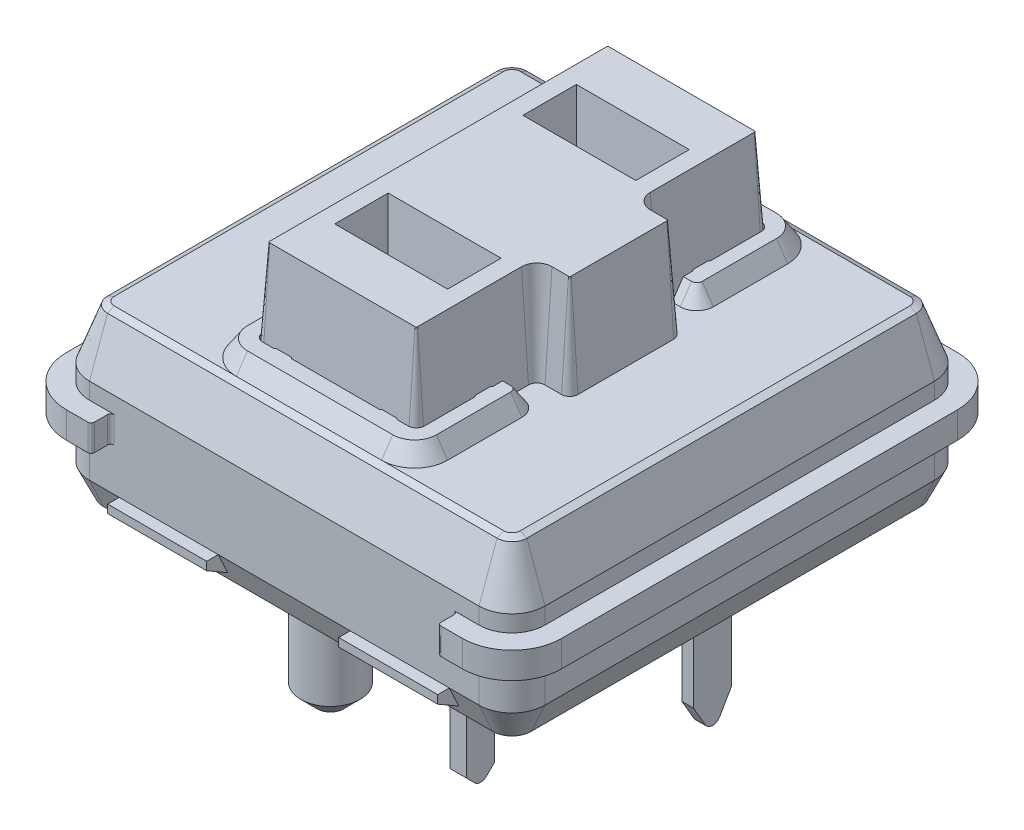
from build123d import *
from OCP.BRepFilletAPI import BRepFilletAPI_MakeChamfer

# Parameters (mm, degrees)
BOSS_EXTRUDE4_DEPTH  = 0.4
BOSS_EXTRUDE5_DEPTH  = 0.5
BOSS_EXTRUDE6_DEPTH  = 1.6
BOSS_EXTRUDE6_TAPER  = 20.000000000000043
CHAMFER1_SIZE        = 0.1
CHAMFER1_SIZE2       = 0.16731571851014881
BOSS_EXTRUDE7_DEPTH  = 0.5
BOSS_EXTRUDE7_TAPER  = 34.000000000000064
CUT_EXTRUDE1_DEPTH   = 11.995908329919814
BOSS_EXTRUDE8_DEPTH  = 0.5
BOSS_EXTRUDE9_DEPTH  = 3
BOSS_EXTRUDE9_DRAFT  = 4.000000000000004
BOSS_EXTRUDE10_START = 1.3
BOSS_EXTRUDE10_DEPTH = 1.3
BOSS_EXTRUDE11_DEPTH = 0.9000000000000002
BOSS_EXTRUDE11_TAPER = 25.000000000000018
CUT_EXTRUDE4_DEPTH   = 4
SKETCH19_R           = 1.6
SKETCH19_R_2         = 0.8999999999999999
BOSS_EXTRUDE12_DEPTH = 2.65
CHAMFER2_SIZE        = 0.5
SKETCH20_W           = 0.34999999999999964
SKETCH20_H           = 1.15
SKETCH20_W_2         = 0.5
SKETCH20_H_2         = 0.8499999999999996
BOSS_EXTRUDE13_DEPTH = 3
CUT_EXTRUDE5_REACH   = 18.489
BOSS_EXTRUDE14_START = 2
BOSS_EXTRUDE14_DEPTH = 3
MIRROR2_START        = 2
MIRROR2_COPY_1_DEPTH = 3
CUT_EXTRUDE6_REACH   = 14.137
SKETCH23_W           = 10.5
SKETCH23_H           = 0.599999999999997
FILLET1_R            = 0.1


with BuildPart() as part:
    # Sketch5 → Boss-Extrude4 (new, symmetric)
    with BuildSketch(Plane(origin=(0, 0, 0), x_dir=(1, 0, 0), z_dir=(0, 1, 0))):
        with BuildLine():
            Line((5.999999999999988, -7.4999999999999964), (-5.999999999999988, -7.4999999999999964))
            ThreePointArc((-5.999999999999988, -7.4999999999999964), (-7.06066017177982, -7.060660171779818), (-7.499999999999999, -5.999999999999986))
            Line((-7.499999999999999, -5.999999999999986), (-7.499999999999999, 5.999999999999986))
            ThreePointArc((-7.499999999999999, 5.999999999999986), (-7.06066017177982, 7.060660171779818), (-5.999999999999988, 7.4999999999999964))
            Line((-5.999999999999988, 7.4999999999999964), (5.999999999999988, 7.4999999999999964))
            ThreePointArc((5.999999999999988, 7.4999999999999964), (7.06066017177982, 7.060660171779817), (7.499999999999999, 5.999999999999986))
            Line((7.499999999999999, 5.999999999999986), (7.499999999999999, -5.999999999999986))
            ThreePointArc((7.499999999999999, -5.999999999999986), (7.06066017177982, -7.060660171779817), (5.999999999999988, -7.4999999999999964))
        make_face()
    extrude(amount=BOSS_EXTRUDE4_DEPTH, both=True)

    # Sketch6 → Boss-Extrude5 (add)
    with BuildSketch(Plane(origin=(0, 0.4, 0), x_dir=(1, 0, 0), z_dir=(0, 1, 0))):
        with BuildLine():
            Line((5.899999999999993, -6.900000000000001), (-5.899999999999995, -6.900000000000001))
            ThreePointArc((-5.899999999999995, -6.900000000000001), (-6.607106781186548, -6.607106781186549), (-6.900000000000001, -5.899999999999995))
            Line((-6.900000000000001, -5.899999999999995), (-6.900000000000001, 5.899999999999992))
            ThreePointArc((-6.900000000000001, 5.899999999999992), (-6.607106781186548, 6.6071067811865465), (-5.899999999999995, 6.899999999999999))
            Line((-5.899999999999995, 6.899999999999999), (5.899999999999992, 6.899999999999999))
            ThreePointArc((5.899999999999992, 6.899999999999999), (6.6071067811865465, 6.6071067811865465), (6.899999999999999, 5.899999999999992))
            Line((6.899999999999999, 5.899999999999992), (6.8999999999999995, -5.899999999999995))
            ThreePointArc((6.8999999999999995, -5.899999999999995), (6.607106781186547, -6.607106781186548), (5.899999999999993, -6.900000000000001))
        make_face()
    extrude(amount=BOSS_EXTRUDE5_DEPTH)

    # Sketch7 → Boss-Extrude6 (add)
    with BuildSketch(Plane(origin=(0, 0.9, 0), x_dir=(1, 0, 0), z_dir=(0, 1, 0))):
        with BuildLine():
            Line((-6.900000000000001, 5.899999999999992), (-6.900000000000001, -5.899999999999995))
            ThreePointArc((-6.900000000000001, -5.899999999999995), (-6.607106781186549, -6.607106781186548), (-5.899999999999995, -6.900000000000001))
            Line((-5.899999999999995, -6.900000000000001), (5.899999999999993, -6.900000000000001))
            ThreePointArc((5.899999999999993, -6.900000000000001), (6.607106781186547, -6.607106781186548), (6.8999999999999995, -5.899999999999995))
            Line((6.8999999999999995, -5.899999999999995), (6.899999999999999, 5.899999999999992))
            ThreePointArc((6.899999999999999, 5.899999999999992), (6.6071067811865465, 6.6071067811865465), (5.899999999999992, 6.899999999999999))
            Line((5.899999999999992, 6.899999999999999), (-5.899999999999995, 6.899999999999999))
            ThreePointArc((-5.899999999999995, 6.899999999999999), (-6.607106781186548, 6.6071067811865465), (-6.900000000000001, 5.899999999999992))
        make_face()
    extrude(amount=BOSS_EXTRUDE6_DEPTH, taper=BOSS_EXTRUDE6_TAPER)

    # Chamfer1: one chamfer whose edges measure the first distance from different faces: ONE call of the kernel's chamfer builder (chamfer() names one face for all edges)
    chamfer1_edges_1 = [part.edges().sort_by_distance(p)[0] for p in [
        (-6.195321467907047, 2.5, -6.1953214679070445),
    ]]
    chamfer1_side_1 = [part.faces().sort_by_distance(p)[0] for p in [
        (-6.401214124546798, 1.7000000000000002, -6.4012141245467955),
    ]]
    chamfer1_edges_2 = [part.edges().sort_by_distance(p)[0] for p in [
        (-6.317647625174076, 2.5, 1.38e-15),
    ]]
    chamfer1_side_2 = [part.faces().sort_by_distance(p)[0] for p in [
        (-6.608823812587039, 1.7, 1.04e-15),
    ]]
    chamfer1_edges_3 = [part.edges().sort_by_distance(p)[0] for p in [
        (-6.195321467907047, 2.5, 6.195321467907046),
    ]]
    chamfer1_side_3 = [part.faces().sort_by_distance(p)[0] for p in [
        (-6.401214124546797, 1.7000000000000002, 6.401214124546797),
    ]]
    chamfer1_edges_4 = [part.edges().sort_by_distance(p)[0] for p in [
        (-1.3e-15, 2.5, 6.317647625174076),
    ]]
    chamfer1_side_4 = [part.faces().sort_by_distance(p)[0] for p in [
        (-8.5e-16, 1.7, 6.608823812587039),
    ]]
    chamfer1_edges_5 = [part.edges().sort_by_distance(p)[0] for p in [
        (6.1953214679070445, 2.5, 6.195321467907047),
    ]]
    chamfer1_side_5 = [part.faces().sort_by_distance(p)[0] for p in [
        (6.4012141245467955, 1.7000000000000002, 6.401214124546797),
    ]]
    chamfer1_edges_6 = [part.edges().sort_by_distance(p)[0] for p in [
        (6.317647625174073, 2.5, -3.9e-16),
    ]]
    chamfer1_side_6 = [part.faces().sort_by_distance(p)[0] for p in [
        (6.608823812587037, 1.7000000000000002, 7e-16),
    ]]
    chamfer1_edges_7 = [part.edges().sort_by_distance(p)[0] for p in [
        (6.195321467907045, 2.5, -6.1953214679070445),
    ]]
    chamfer1_side_7 = [part.faces().sort_by_distance(p)[0] for p in [
        (6.4012141245467955, 1.7000000000000002, -6.4012141245467955),
    ]]
    chamfer1_edges_8 = [part.edges().sort_by_distance(p)[0] for p in [
        (-4.1e-16, 2.5, -6.317647625174073),
    ]]
    chamfer1_side_8 = [part.faces().sort_by_distance(p)[0] for p in [
        (-8.5e-16, 1.7, -6.608823812587036),
    ]]
    chamfer1 = BRepFilletAPI_MakeChamfer(part.part.solid().wrapped)
    for e in chamfer1_edges_1:
        chamfer1.Add(CHAMFER1_SIZE, CHAMFER1_SIZE2, e.wrapped, chamfer1_side_1[0].wrapped)  # the first distance lies on this face
    for e in chamfer1_edges_2:
        chamfer1.Add(CHAMFER1_SIZE, CHAMFER1_SIZE2, e.wrapped, chamfer1_side_2[0].wrapped)  # the first distance lies on this face
    for e in chamfer1_edges_3:
        chamfer1.Add(CHAMFER1_SIZE, CHAMFER1_SIZE2, e.wrapped, chamfer1_side_3[0].wrapped)  # the first distance lies on this face
    for e in chamfer1_edges_4:
        chamfer1.Add(CHAMFER1_SIZE, CHAMFER1_SIZE2, e.wrapped, chamfer1_side_4[0].wrapped)  # the first distance lies on this face
    for e in chamfer1_edges_5:
        chamfer1.Add(CHAMFER1_SIZE, CHAMFER1_SIZE2, e.wrapped, chamfer1_side_5[0].wrapped)  # the first distance lies on this face
    for e in chamfer1_edges_6:
        chamfer1.Add(CHAMFER1_SIZE, CHAMFER1_SIZE2, e.wrapped, chamfer1_side_6[0].wrapped)  # the first distance lies on this face
    for e in chamfer1_edges_7:
        chamfer1.Add(CHAMFER1_SIZE, CHAMFER1_SIZE2, e.wrapped, chamfer1_side_7[0].wrapped)  # the first distance lies on this face
    for e in chamfer1_edges_8:
        chamfer1.Add(CHAMFER1_SIZE, CHAMFER1_SIZE2, e.wrapped, chamfer1_side_8[0].wrapped)  # the first distance lies on this face
    add(Compound.cast(chamfer1.Shape()), mode=Mode.REPLACE)

    # Sketch8 → Boss-Extrude7 (add)
    with BuildSketch(Plane(origin=(0, 2.5, 0), x_dir=(1, 0, 0), z_dir=(0, 1, 0))):
        with BuildLine():
            ThreePointArc((2.1999999999999926, -6.150331906663926), (2.907106781186547, -5.857438687850474), (3.1999999999999997, -5.150331906663919))
            Line((3.1999999999999997, -5.150331906663919), (3.1999999999999997, -2.9003319066639257))
            ThreePointArc((3.1999999999999997, -2.9003319066639257), (3.0535533905932737, -2.5467785160706518), (2.6999999999999997, -2.4003319066639257))
            Line((2.6999999999999997, -2.4003319066639257), (2.3000000000000003, -2.4003319066639257))
            Line((2.3000000000000003, -2.4003319066639257), (2.3, 2.4003319066639257))
            Line((2.3, 2.4003319066639257), (2.699999999999996, 2.4003319066639257))
            ThreePointArc((2.699999999999996, 2.4003319066639257), (3.0535533905932737, 2.5467785160706518), (3.1999999999999997, 2.9003319066639293))
            Line((3.1999999999999997, 2.9003319066639293), (3.1999999999999997, 5.150331906663919))
            ThreePointArc((3.1999999999999997, 5.150331906663919), (2.907106781186547, 5.857438687850474), (2.1999999999999926, 6.150331906663926))
            Line((2.1999999999999926, 6.150331906663926), (-2.1999999999999935, 6.150331906663926))
            ThreePointArc((-2.1999999999999935, 6.150331906663926), (-2.907106781186548, 5.857438687850474), (-3.2000000000000006, 5.150331906663919))
            Line((-3.2000000000000006, 5.150331906663919), (-3.2000000000000006, -5.150331906663919))
            ThreePointArc((-3.2000000000000006, -5.150331906663919), (-2.907106781186548, -5.857438687850474), (-2.1999999999999935, -6.150331906663926))
            Line((-2.1999999999999935, -6.150331906663926), (2.1999999999999926, -6.150331906663926))
        make_face()
    extrude(amount=BOSS_EXTRUDE7_DEPTH, taper=BOSS_EXTRUDE7_TAPER)

    # Sketch9 → Cut-Extrude1 (cut, through all)
    with BuildSketch(Plane(origin=(0, 2.5, 0), x_dir=(1, 0, 0), z_dir=(0, 1, 0))):
        with BuildLine():
            Line((-2.1999999999999997, -5.35), (2.2, -5.35))
            ThreePointArc((2.2, -5.35), (2.376776695296637, -5.276776695296636), (2.4500000000000006, -5.1))
            Line((2.4500000000000006, -5.1), (2.4500000000000006, 5.1))
            ThreePointArc((2.4500000000000006, 5.1), (2.376776695296637, 5.276776695296636), (2.2, 5.35))
            Line((2.2, 5.35), (-2.1999999999999997, 5.35))
            ThreePointArc((-2.1999999999999997, 5.35), (-2.3767766952966367, 5.276776695296636), (-2.4499999999999997, 5.1))
            Line((-2.4499999999999997, 5.1), (-2.4499999999999997, -5.1))
            ThreePointArc((-2.4499999999999997, -5.1), (-2.3767766952966367, -5.276776695296636), (-2.1999999999999997, -5.35))
        make_face()
    extrude(amount=CUT_EXTRUDE1_DEPTH, mode=Mode.SUBTRACT)

    # Sketch11 → Boss-Extrude8 (add)
    with BuildSketch(Plane(origin=(0, 2.5, 0), x_dir=(1, 0, 0), z_dir=(0, 1, 0))):
        with BuildLine():
            Line((-1.8598076211353325, 5.35), (-1.3401923788646686, 5.3500000000000005))
            ThreePointArc((-1.3401923788646686, 5.3500000000000005), (-1.6000000000000003, 5.199999999999999), (-1.8598076211353325, 5.35))
        make_face()
        with BuildLine():
            Line((1.3401923788646686, 5.3500000000000005), (1.8598076211353325, 5.35))
            ThreePointArc((1.8598076211353325, 5.35), (1.6000000000000003, 5.199999999999999), (1.3401923788646686, 5.3500000000000005))
        make_face()
        with BuildLine():
            Line((2.4500000000000006, 3.5598076211353322), (2.4500000000000006, 3.040192378864668))
            ThreePointArc((2.4500000000000006, 3.040192378864668), (2.2999999999999994, 3.3), (2.4500000000000006, 3.5598076211353322))
        make_face()
        with BuildLine():
            Line((2.4500000000000006, -3.0401923788646683), (2.4500000000000006, -3.5598076211353313))
            ThreePointArc((2.4500000000000006, -3.5598076211353313), (2.3000000000000007, -3.3), (2.4500000000000006, -3.0401923788646683))
        make_face()
        with BuildLine():
            Line((1.859807621135331, -5.35), (1.3401923788646677, -5.35))
            ThreePointArc((1.3401923788646677, -5.35), (1.6, -5.199999999999998), (1.859807621135331, -5.35))
        make_face()
        with BuildLine():
            Line((-1.3401923788646677, -5.35), (-1.859807621135331, -5.35))
            ThreePointArc((-1.859807621135331, -5.35), (-1.5999999999999992, -5.199999999999999), (-1.3401923788646677, -5.35))
        make_face()
        with BuildLine():
            Line((-2.4499999999999997, -3.5598076211353313), (-2.4499999999999993, -3.0401923788646683))
            ThreePointArc((-2.4499999999999993, -3.0401923788646683), (-2.2999999999999994, -3.3000000000000003), (-2.4499999999999997, -3.5598076211353313))
        make_face()
        with BuildLine():
            Line((-2.449999999999999, 3.0401923788646683), (-2.449999999999999, 3.5598076211353313))
            ThreePointArc((-2.449999999999999, 3.5598076211353313), (-2.299999999999999, 3.3), (-2.449999999999999, 3.0401923788646683))
        make_face()
    extrude(amount=BOSS_EXTRUDE8_DEPTH)


with BuildPart() as boss_extrude9_tool:
    # Sketch12 → Boss-Extrude9 (with draft: the straight prism first)
    with BuildSketch(Plane(origin=(0, 2.5, 0), x_dir=(1, 0, 0), z_dir=(0, 1, 0))):
        with BuildLine():
            ThreePointArc((2.6999999999999993, 1.6999999999999997), (2.5232233047033628, 1.7732233047033628), (2.4499999999999993, 1.9499999999999995))
            Line((2.4499999999999993, 1.9499999999999995), (2.4499999999999997, 5.099999999999998))
            ThreePointArc((2.4499999999999997, 5.099999999999998), (2.3767766952966367, 5.276776695296637), (2.199999999999998, 5.35))
            Line((2.199999999999998, 5.35), (-2.199999999999998, 5.35))
            ThreePointArc((-2.199999999999998, 5.35), (-2.3767766952966367, 5.276776695296637), (-2.4499999999999997, 5.099999999999998))
            Line((-2.4499999999999997, 5.099999999999998), (-2.4499999999999997, -5.099999999999998))
            ThreePointArc((-2.4499999999999997, -5.099999999999998), (-2.3767766952966367, -5.276776695296637), (-2.199999999999998, -5.35))
            Line((-2.199999999999998, -5.35), (2.199999999999998, -5.35))
            ThreePointArc((2.199999999999998, -5.35), (2.3767766952966367, -5.276776695296636), (2.4499999999999997, -5.099999999999998))
            Line((2.4499999999999997, -5.099999999999998), (2.449999999999999, -1.9500000000000004))
            ThreePointArc((2.449999999999999, -1.9500000000000004), (2.5232233047033623, -1.7732233047033634), (2.6999999999999993, -1.7000000000000004))
            Line((2.6999999999999993, -1.7000000000000004), (3.1999999999999975, -1.7000000000000006))
            ThreePointArc((3.1999999999999975, -1.7000000000000006), (3.3767766952966363, -1.6267766952966372), (3.4499999999999993, -1.4499999999999986))
            Line((3.4499999999999993, -1.4499999999999986), (3.4499999999999993, 1.449999999999998))
            ThreePointArc((3.4499999999999993, 1.449999999999998), (3.3767766952966363, 1.6267766952966367), (3.1999999999999975, 1.6999999999999997))
            Line((3.1999999999999975, 1.6999999999999997), (2.6999999999999993, 1.6999999999999997))
        make_face()
        Polygon((-1.5000000000000004, -2.2500000000000013), (1.4999999999999996, -2.2500000000000013), (1.5, -3.4500000000000006), (-1.5, -3.4500000000000006), align=None, mode=Mode.SUBTRACT)
        Polygon((1.4999999999999996, 2.2500000000000013), (1.5, 3.4500000000000006), (-1.5, 3.4500000000000006), (-1.5000000000000004, 2.2500000000000013), align=None, mode=Mode.SUBTRACT)
    extrude(amount=BOSS_EXTRUDE9_DEPTH)
    # Boss-Extrude9: the draft: its side faces are tilted about the plane it starts from
    boss_extrude9_sides = [boss_extrude9_tool.faces().sort_by_distance(p)[0] for p in [
        (2.95, 4, -1.7),
        (2.523223305, 4, -1.773223305),
        (2.45, 4, -3.525),
        (2.376776695, 4, -5.276776695),
        (0, 4, -5.35),
        (-2.376776695, 4, -5.276776695),
        (-2.45, 4, 0),
        (-2.376776695, 4, 5.276776695),
        (0, 4, 5.35),
        (2.376776695, 4, 5.276776695),
        (2.45, 4, 3.525),
        (2.523223305, 4, 1.773223305),
        (2.95, 4, 1.7),
        (3.376776695, 4, 1.626776695),
        (3.45, 4, 0),
        (3.376776695, 4, -1.626776695),
        (0, 4, 2.25),
        (1.5, 4, 2.85),
        (0, 4, 3.45),
        (-1.5, 4, 2.85),
        (0, 4, -2.25),
        (-1.5, 4, -2.85),
        (0, 4, -3.45),
        (1.5, 4, -2.85),
    ]]
    draft(boss_extrude9_sides, Plane(origin=(0, 2.5, 0), x_dir=(1, 0, 0), z_dir=(0, 1, 0)), BOSS_EXTRUDE9_DRAFT)


with BuildPart() as part_1:
    add(part.part)

    # Boss-Extrude9: add boss_extrude9_tool
    add(boss_extrude9_tool.part)

    # Sketch16 → Boss-Extrude10 (add)
    with BuildSketch(Plane.XZ.offset(0.4).offset(BOSS_EXTRUDE10_START)):
        with BuildLine():
            Line((5.900000000000002, -6.900000000000002), (-5.899999999999999, -6.900000000000004))
            ThreePointArc((-5.899999999999999, -6.900000000000004), (-6.6071067811865465, -6.607106781186552), (-6.899999999999999, -5.900000000000004))
            Line((-6.899999999999999, -5.900000000000004), (-6.899999999999999, 5.8999999999999915))
            ThreePointArc((-6.899999999999999, 5.8999999999999915), (-6.6071067811865465, 6.607106781186545), (-5.899999999999992, 6.899999999999999))
            Line((-5.899999999999992, 6.899999999999999), (5.900000000000002, 6.8999999999999995))
            ThreePointArc((5.900000000000002, 6.8999999999999995), (6.60710678118655, 6.6071067811865465), (6.900000000000002, 5.8999999999999995))
            Line((6.900000000000002, 5.8999999999999995), (6.900000000000002, -5.900000000000002))
            ThreePointArc((6.900000000000002, -5.900000000000002), (6.60710678118655, -6.60710678118655), (5.900000000000002, -6.900000000000002))
        make_face()
    extrude(amount=-BOSS_EXTRUDE10_DEPTH)

    # Sketch17 → Boss-Extrude11 (add)
    with BuildSketch(Plane.XZ.offset(1.7)):
        with BuildLine():
            Line((-5.899999999999999, -6.900000000000004), (5.900000000000002, -6.900000000000002))
            ThreePointArc((5.900000000000002, -6.900000000000002), (6.60710678118655, -6.60710678118655), (6.900000000000002, -5.900000000000002))
            Line((6.900000000000002, -5.900000000000002), (6.900000000000002, 5.8999999999999995))
            ThreePointArc((6.900000000000002, 5.8999999999999995), (6.60710678118655, 6.6071067811865465), (5.900000000000002, 6.8999999999999995))
            Line((5.900000000000002, 6.8999999999999995), (-5.899999999999992, 6.899999999999999))
            ThreePointArc((-5.899999999999992, 6.899999999999999), (-6.6071067811865465, 6.607106781186546), (-6.899999999999999, 5.8999999999999915))
            Line((-6.899999999999999, 5.8999999999999915), (-6.899999999999999, -5.900000000000004))
            ThreePointArc((-6.899999999999999, -5.900000000000004), (-6.6071067811865465, -6.607106781186552), (-5.899999999999999, -6.900000000000004))
        make_face()
    extrude(amount=BOSS_EXTRUDE11_DEPTH, taper=BOSS_EXTRUDE11_TAPER)

    # Sketch18 → Cut-Extrude4 (cut)
    with BuildSketch(Plane.XZ.offset(2.6)):
        Polygon((-6.275, 2.5000000000000013), (-3.125, 2.5000000000000013), (-3.1249999999999996, -2.4999999999999987), (-6.2749999999999995, -2.4999999999999987), align=None)
    extrude(amount=-CUT_EXTRUDE4_DEPTH, mode=Mode.SUBTRACT)

    # Sketch19 → Boss-Extrude12 (add)
    with BuildSketch(Plane.XZ.offset(2.6)):
        with Locations(Location((0, 0, 0), (0, 0, 270))):
            Circle(SKETCH19_R)
        with Locations(Location((0, 5.5, 0), (0, 0, 270))):
            Circle(SKETCH19_R_2)
        with Locations(Location((0, -5.5, 0), (0, 0, 90))):
            Circle(SKETCH19_R_2)
    extrude(amount=BOSS_EXTRUDE12_DEPTH)

    # Chamfer2
    chamfer2_edges = [part_1.edges().sort_by_distance(p)[0] for p in [
        (4.9e-16, -5.25, 1.6),
        (2.8e-16, -5.25, 6.4),
        (-1.7e-16, -5.25, -6.4),
    ]]
    chamfer(chamfer2_edges, length=CHAMFER2_SIZE)

    # Sketch20 → Boss-Extrude13 (add)
    with BuildSketch(Plane.XZ.offset(2.6)):
        with Locations((5.9, 0)):
            Rectangle(SKETCH20_W, SKETCH20_H)
        with Locations((3.8, 5)):
            Rectangle(SKETCH20_W_2, SKETCH20_H_2)
    extrude(amount=BOSS_EXTRUDE13_DEPTH)

    # Cut-Extrude5: up to this face of the body (flat: up to its plane)
    cut_extrude5_end = Plane(part_1.part.faces().sort_by_distance((3.55, -4.1, 5))[0])
    # Sketch21 → Cut-Extrude5 (cut, up to the picked face)
    with BuildSketch(Plane(origin=(6.075, 0, 0), x_dir=(0, 0, -1), z_dir=(1, 0, 0)), mode=Mode.PRIVATE) as cut_extrude5_sk1:
        with BuildLine():
            Line((-0.575, -4.854070785647886), (-0.2165063509461105, -5.474999999999999))
            ThreePointArc((-0.2165063509461105, -5.474999999999999), (2.4e-16, -5.6), (0.21650635094610995, -5.474999999999998))
            Line((0.21650635094610995, -5.474999999999998), (0.575, -4.854070785647887))
            Line((0.575, -4.854070785647887), (0.575, -6.700000000000001))
            Line((0.575, -6.700000000000001), (-5.425, -6.700000000000001))
            Line((-5.425, -6.700000000000001), (-5.425, -5.278553390593272))
            Line((-5.425, -5.278553390593272), (-5.176776695296639, -5.526776695296636))
            ThreePointArc((-5.176776695296639, -5.526776695296636), (-5.000000000000001, -5.6000000000000005), (-4.823223304703363, -5.526776695296636))
            Line((-4.823223304703363, -5.526776695296636), (-4.575, -5.278553390593272))
            Line((-4.575, -5.278553390593272), (-4.575, -5.7))
            Line((-4.575, -5.7), (-0.5749999999999998, -5.7))
            Line((-0.5749999999999998, -5.7), (-0.575, -4.854070785647886))
        make_face()
    cut_extrude5_tool1 = split(extrude(cut_extrude5_sk1.sketch, amount=-CUT_EXTRUDE5_REACH, mode=Mode.PRIVATE), bisect_by=cut_extrude5_end, keep=Keep.BOTH, mode=Mode.PRIVATE)
    add(cut_extrude5_tool1.solids().sort_by(Axis((6.075, -6.130426, 2.337222), (-1, 0, 0)))[0], mode=Mode.SUBTRACT)

    # Sketch22 → Boss-Extrude14 (add)
    with BuildSketch(Plane(origin=(0, 0, 0), x_dir=(0, 0, -1), z_dir=(1, 0, 0)).offset(BOSS_EXTRUDE14_START)):
        Polygon((-6.8999999999999995, -1.7), (-7.25, -1.7), (-7.25, -1.95), (-6.611533244723425, -2.3186189530275523), align=None)
    boss_extrude14 = extrude(amount=BOSS_EXTRUDE14_DEPTH)

    # Mirror1: Boss-Extrude14 across plane
    add(boss_extrude14.mirror(Plane(origin=(0, 0, 0), x_dir=(0, 0, 1), z_dir=(1, 0, 0))))

    # Mirror2: Boss-Extrude14 across plane
    add(boss_extrude14.mirror(Plane.XY))

    # Mirror2 copy 1 sketch → Mirror2 copy 1 (add)
    with BuildSketch(Plane.ZY.offset(MIRROR2_START)):
        Polygon((-6.8999999999999995, -1.7), (-7.25, -1.7), (-7.25, -1.95), (-6.611533244723425, -2.3186189530275523), align=None)
    extrude(amount=MIRROR2_COPY_1_DEPTH)

    # Sketch23 → Cut-Extrude6 (cut, up to next)
    with BuildSketch(Plane.XZ.offset(0.4), mode=Mode.PRIVATE) as cut_extrude6_sk1:
        with Locations((0, 7.1999999999999975)):
            Rectangle(SKETCH23_W, SKETCH23_H)
    cut_extrude6_tool1 = extrude(cut_extrude6_sk1.sketch, amount=-CUT_EXTRUDE6_REACH, mode=Mode.PRIVATE) & part_1.part
    # Sketch23 → Cut-Extrude6 (cut, up to next)
    with BuildSketch(Plane.XZ.offset(0.4), mode=Mode.PRIVATE) as cut_extrude6_sk2:
        with Locations((0, -7.1999999999999975)):
            Rectangle(SKETCH23_W, SKETCH23_H)
    cut_extrude6_tool2 = extrude(cut_extrude6_sk2.sketch, amount=-CUT_EXTRUDE6_REACH, mode=Mode.PRIVATE) & part_1.part
    add(cut_extrude6_tool1.solids().sort_by_distance((0, -0.4, 7.2))[0], mode=Mode.SUBTRACT)
    add(cut_extrude6_tool2.solids().sort_by_distance((0, -0.4, -7.2))[0], mode=Mode.SUBTRACT)

    # Fillet1
    fillet1_edges = [part_1.edges().sort_by_distance(p)[0] for p in [
        (-5.25, 0, 6.8999999999999995),
        (-5.25, 0, 7.4999999999999964),
        (5.25, 0, 7.4999999999999964),
        (5.25, 0, 6.8999999999999995),
        (5.25, 0, -7.4999999999999964),
        (-5.25, 0, -7.4999999999999964),
        (-5.25, 0, -6.8999999999999995),
        (5.25, 0, -6.8999999999999995),
    ]]
    fillet(fillet1_edges, radius=FILLET1_R)


solid = part_1.part
